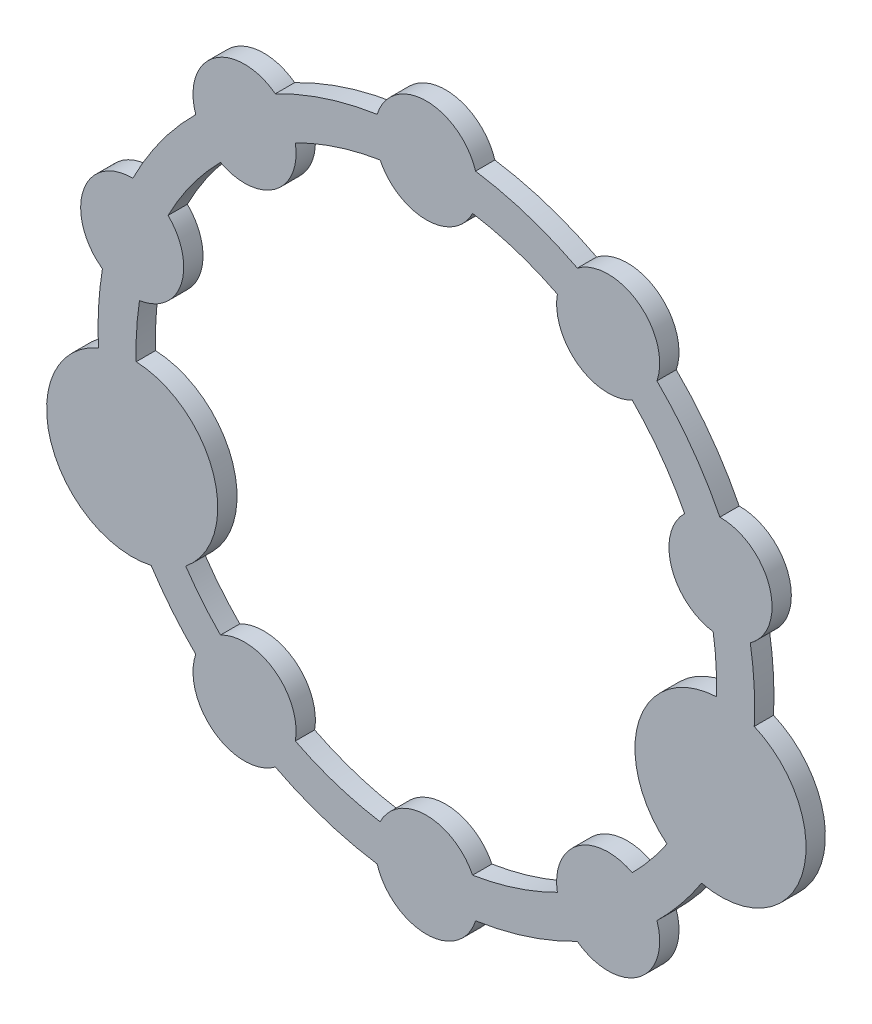
from build123d import *

# Parameters (mm, degrees)
SKETCH1_R              = 5.42
BOSS_EXTRUDE1_DEPTH    = 2.03
BOSS_EXTRUDE1_2_DEPTH  = 2.03
BOSS_EXTRUDE1_3_DEPTH  = 2.03
BOSS_EXTRUDE1_4_DEPTH  = 2.03
BOSS_EXTRUDE1_5_DEPTH  = 2.03
BOSS_EXTRUDE1_6_DEPTH  = 2.03
BOSS_EXTRUDE1_7_DEPTH  = 2.03
BOSS_EXTRUDE1_8_DEPTH  = 2.03
BOSS_EXTRUDE1_9_DEPTH  = 2.03
BOSS_EXTRUDE1_10_DEPTH = 2.03
SKETCH2_R              = 34.53
SKETCH2_R_2            = 30.53
BOSS_EXTRUDE2_DEPTH    = 2.03
SKETCH3_R              = 9
BOSS_EXTRUDE3_DEPTH    = 2.03


with BuildPart() as part:
    # Sketch1 → Boss-Extrude1 (new body)
    with BuildSketch(Plane.XY):
        with Locations((0, -32.53)):
            Circle(SKETCH1_R)
    extrude(amount=BOSS_EXTRUDE1_DEPTH)



with BuildPart() as body_2:
    # Sketch1 → Boss-Extrude1 2 (new body)
    with BuildSketch(Plane.XY):
        with Locations((-19.120654257, -26.317322827)):
            Circle(SKETCH1_R)
    extrude(amount=BOSS_EXTRUDE1_2_DEPTH)


with BuildPart() as body_3:
    # Sketch1 → Boss-Extrude1 3 (new body)
    with BuildSketch(Plane.XY):
        with Locations((-30.937868475, -10.052322827)):
            Circle(SKETCH1_R)
    extrude(amount=BOSS_EXTRUDE1_3_DEPTH)


with BuildPart() as body_4:
    # Sketch1 → Boss-Extrude1 4 (new body)
    with BuildSketch(Plane.XY):
        with Locations((-30.937868475, 10.052322827)):
            Circle(SKETCH1_R)
    extrude(amount=BOSS_EXTRUDE1_4_DEPTH)


with BuildPart() as body_5:
    # Sketch1 → Boss-Extrude1 5 (new body)
    with BuildSketch(Plane.XY):
        with Locations((-19.120654257, 26.317322827)):
            Circle(SKETCH1_R)
    extrude(amount=BOSS_EXTRUDE1_5_DEPTH)


with BuildPart() as body_6:
    # Sketch1 → Boss-Extrude1 6 (new body)
    with BuildSketch(Plane.XY):
        with Locations((0, 32.53)):
            Circle(SKETCH1_R)
    extrude(amount=BOSS_EXTRUDE1_6_DEPTH)


with BuildPart() as body_7:
    # Sketch1 → Boss-Extrude1 7 (new body)
    with BuildSketch(Plane.XY):
        with Locations((19.120654257, 26.317322827)):
            Circle(SKETCH1_R)
    extrude(amount=BOSS_EXTRUDE1_7_DEPTH)


with BuildPart() as body_8:
    # Sketch1 → Boss-Extrude1 8 (new body)
    with BuildSketch(Plane.XY):
        with Locations((30.937868475, 10.052322827)):
            Circle(SKETCH1_R)
    extrude(amount=BOSS_EXTRUDE1_8_DEPTH)


with BuildPart() as body_9:
    # Sketch1 → Boss-Extrude1 9 (new body)
    with BuildSketch(Plane.XY):
        with Locations((30.937868475, -10.052322827)):
            Circle(SKETCH1_R)
    extrude(amount=BOSS_EXTRUDE1_9_DEPTH)


with BuildPart() as body_10:
    # Sketch1 → Boss-Extrude1 10 (new body)
    with BuildSketch(Plane.XY):
        with Locations((19.120654257, -26.317322827)):
            Circle(SKETCH1_R)
    extrude(amount=BOSS_EXTRUDE1_10_DEPTH)


with BuildPart() as part_1:
    add(part.part)

    add(body_2.part)  # Boss-Extrude2 merges body 2

    add(body_3.part)  # Boss-Extrude2 merges body 3

    add(body_4.part)  # Boss-Extrude2 merges body 4

    add(body_5.part)  # Boss-Extrude2 merges body 5

    add(body_6.part)  # Boss-Extrude2 merges body 6

    add(body_7.part)  # Boss-Extrude2 merges body 7

    add(body_8.part)  # Boss-Extrude2 merges body 8

    add(body_9.part)  # Boss-Extrude2 merges body 9

    add(body_10.part)  # Boss-Extrude2 merges body 10
    # Sketch2 → Boss-Extrude2 (add)
    with BuildSketch(Plane.XY.offset(2.03)):
        Circle(SKETCH2_R)
        Circle(SKETCH2_R_2, mode=Mode.SUBTRACT)
    extrude(amount=-BOSS_EXTRUDE2_DEPTH)

    # Sketch3 → Boss-Extrude3 (add)
    with BuildSketch(Plane.XY.offset(2.03)):
        with Locations((-30.937868475, -10.052322827)):
            Circle(SKETCH3_R)
    boss_extrude3 = extrude(amount=-BOSS_EXTRUDE3_DEPTH)

    # Mirror1: Boss-Extrude3 across plane
    add(boss_extrude3.mirror(Plane(origin=(0, 0, 0), x_dir=(0, 0, 1), z_dir=(1, 0, 0))))


solid = part_1.part
